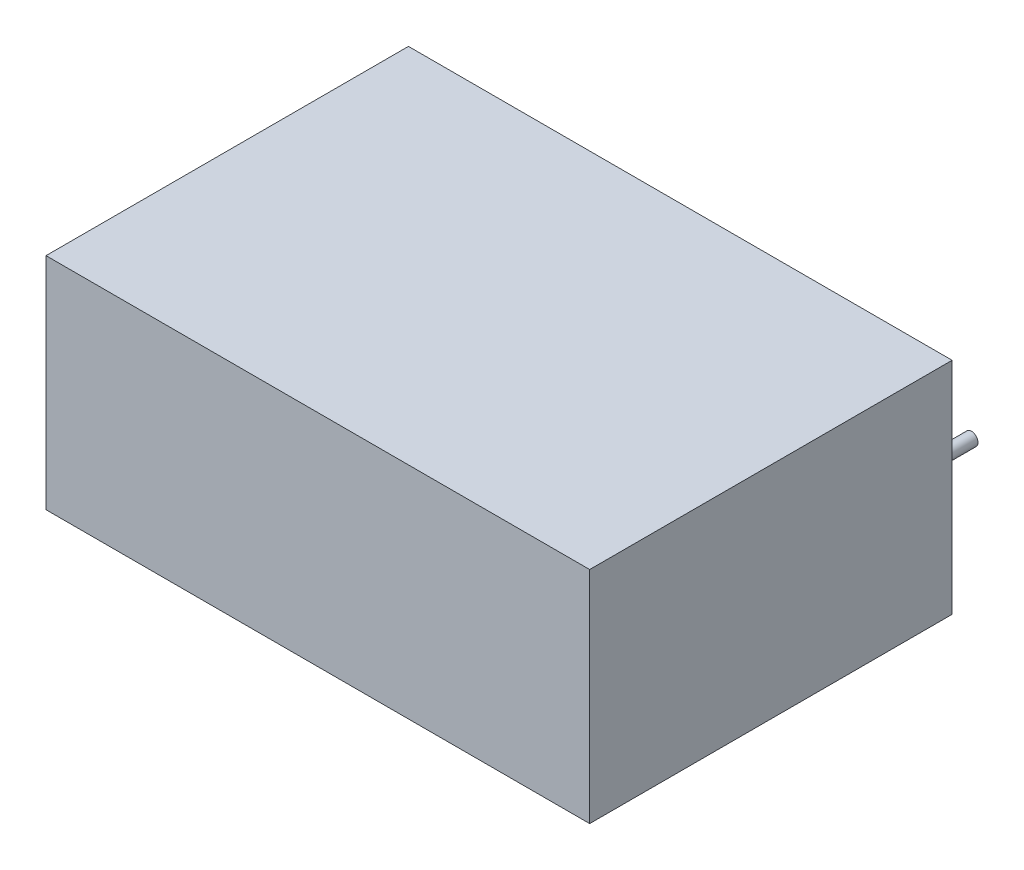
from build123d import *

# Parameters (mm, degrees)
SKETCH_2_W      = 42
SKETCH_2_H      = 17
EXTRUDE_1_DEPTH = 28
SKETCH_3_R      = 0.5
EXTRUDE_2_DEPTH = 4


with BuildPart() as part:
    # Эскиз2 → Вытянуть1 (new body)
    with BuildSketch(Plane.XY):
        with Locations((20.5, -0.5)):
            Rectangle(SKETCH_2_W, SKETCH_2_H)
    extrude(amount=EXTRUDE_1_DEPTH)

    # Эскиз3 → Вытянуть2 (add)
    with BuildSketch(Plane(origin=(0, 0, 0), x_dir=(-1, 0, 0), z_dir=(0, 0, -1))):
        with Locations(Location((-2, -0.5, 0), (0, 0, 180))):
            Circle(SKETCH_3_R)
        with Locations(Location((-39, -0.5, 0), (0, 0, 180))):
            Circle(SKETCH_3_R)
    extrude(amount=EXTRUDE_2_DEPTH)


solid = part.part
